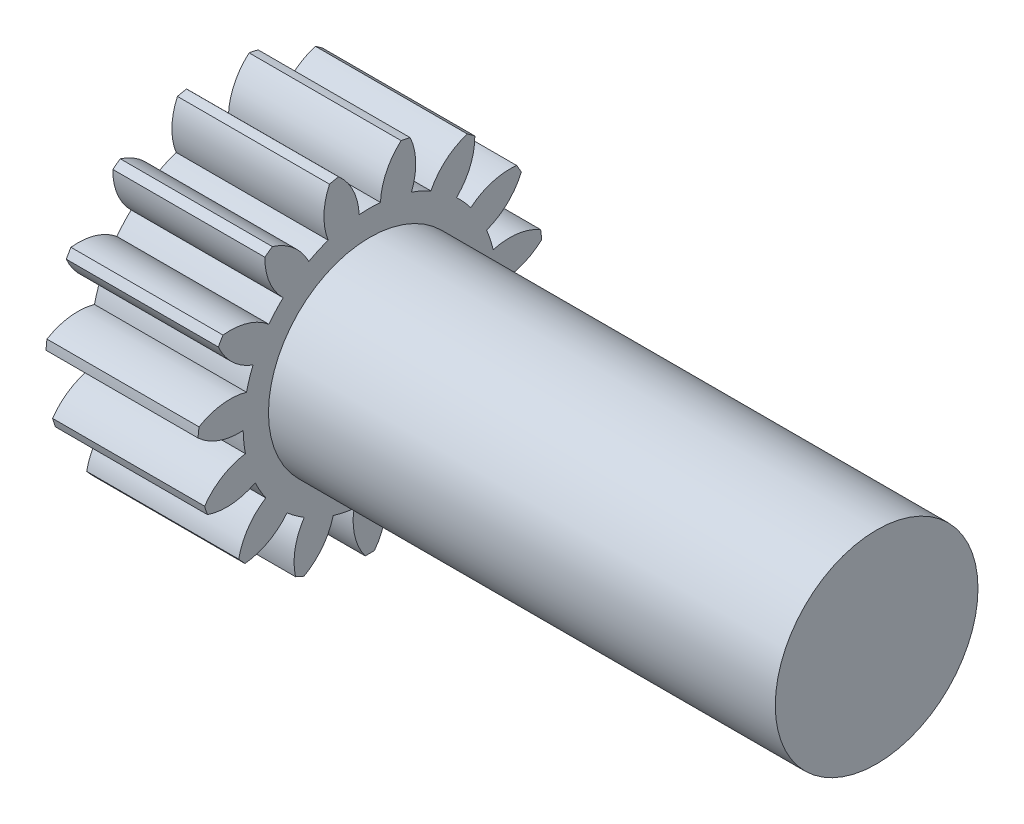
from build123d import *

# Parameters (mm, degrees)
BASPROSKE_W         = 15
BASPROSKE_H         = 17
TOOTHCUT_DEPTH      = 29.337254631
TEETHCUTS_COUNT     = 15
TEETHCUTS_ANGLE     = 336
BORSKE_R            = 2.5
BORE_DEPTH          = 50.0000508
SKETCH1_R           = 10
BOSS_EXTRUDE1_DEPTH = 50
CUT_EXTRUDE3_START  = -20
SKETCH2_R           = 2.5
CUT_EXTRUDE3_DEPTH  = 20


with BuildPart() as part:
    # BasProSke → Base-Revolve (revolve)
    with BuildSketch(Plane(origin=(0, 0, 0), x_dir=(1, 0, 0), z_dir=(0, 1, 0)), mode=Mode.PRIVATE) as base_revolve_sk:
        with Locations((7.5, 8.5)):
            Rectangle(BASPROSKE_W, BASPROSKE_H)
    revolve(base_revolve_sk.sketch.rotate(Axis((-10, 0, 0), (1, 0, 0)), 180), axis=Axis((-10, 0, 0), (1, 0, 0)))

    # TooCutSke → ToothCut (cut, through all)
    with BuildSketch(Plane(origin=(0, 0, 0), x_dir=(0, 0, -1), z_dir=(1, 0, 0))):
        with BuildLine():
            ThreePointArc((1.050056448, 12.454813626), (0, 12.499), (-1.050056448, 12.454813626))
            ThreePointArc((-1.050056448, 12.454813626), (-1.638118106, 14.809604533), (-3.110934279, 16.73876737))
            ThreePointArc((-3.110934279, 16.73876737), (0, 17.0254), (3.110934279, 16.73876737))
            ThreePointArc((3.110934279, 16.73876737), (1.638118106, 14.809604533), (1.050056448, 12.454813626))
        make_face()
    toothcut = extrude(amount=TOOTHCUT_DEPTH, mode=Mode.SUBTRACT)

    # TeethCuts: ToothCut ×15 about axis
    teethcuts_axis = Axis((-10, 0, 0), (1, 0, 0))
    for i in range(1, TEETHCUTS_COUNT):
        add(toothcut.rotate(teethcuts_axis, i * TEETHCUTS_ANGLE / (TEETHCUTS_COUNT - 1)), mode=Mode.SUBTRACT)

    # BorSke → Bore (cut, symmetric)
    with BuildSketch(Plane(origin=(0, 0, 0), x_dir=(0, 0, -1), z_dir=(1, 0, 0))):
        with Locations(Location((0, 0, 0), (0, 0, 180))):
            Circle(BORSKE_R)
    extrude(amount=BORE_DEPTH, both=True, mode=Mode.SUBTRACT)

    # Sketch1 → Boss-Extrude1 (add)
    with BuildSketch(Plane(origin=(15, 0, 0), x_dir=(0, 0, -1), z_dir=(1, 0, 0))):
        with Locations(Location((0, 0, 0), (0, 0, 180))):
            Circle(SKETCH1_R)
    extrude(amount=BOSS_EXTRUDE1_DEPTH)

    # Sketch2 → Cut-Extrude3 (cut)
    with BuildSketch(Plane.ZY.offset(CUT_EXTRUDE3_START)):
        Circle(SKETCH2_R)
    extrude(amount=CUT_EXTRUDE3_DEPTH, mode=Mode.SUBTRACT)


solid = part.part
